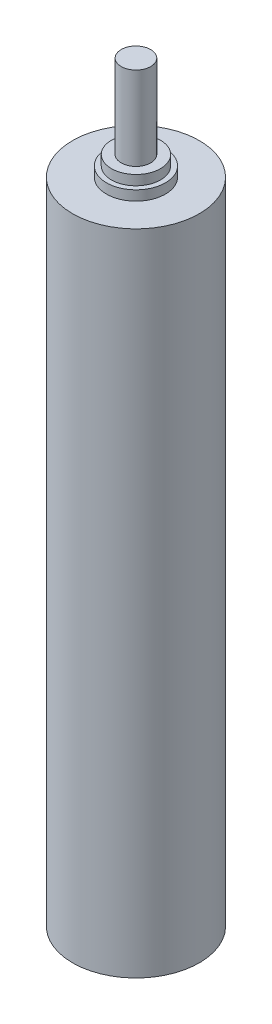
from build123d import *

# Parameters (mm, degrees)
SKETCH1_R           = 6.4516
BOSS_EXTRUDE1_DEPTH = 66.04


with BuildPart() as part:
    # Sketch1 → Boss-Extrude1 (new body)
    with BuildSketch(Plane(origin=(0, 0, 0), x_dir=(1, 0, 0), z_dir=(0, 1, 0))):
        with Locations(Location((0, 0, 0), (0, 0, 270))):
            Circle(SKETCH1_R)
    extrude(amount=BOSS_EXTRUDE1_DEPTH)

    # Sketch2 → Revolve1 (revolve)
    with BuildSketch(Plane(origin=(0, 0, 0), x_dir=(0, 0, -1), z_dir=(1, 0, 0)), mode=Mode.PRIVATE) as revolve1_sk:
        Polygon((0, 66.04), (0, 76.54), (-1.5, 76.54), (-1.5, 68.04), (-2.5, 68.04), (-2.5, 67.04), (-3, 67.04), (-3, 66.04), align=None)
    revolve(revolve1_sk.sketch.rotate(Axis((0, 66.04, 0), (0, 1, 0)), 180), axis=Axis((0, 66.04, 0), (0, 1, 0)))


solid = part.part
